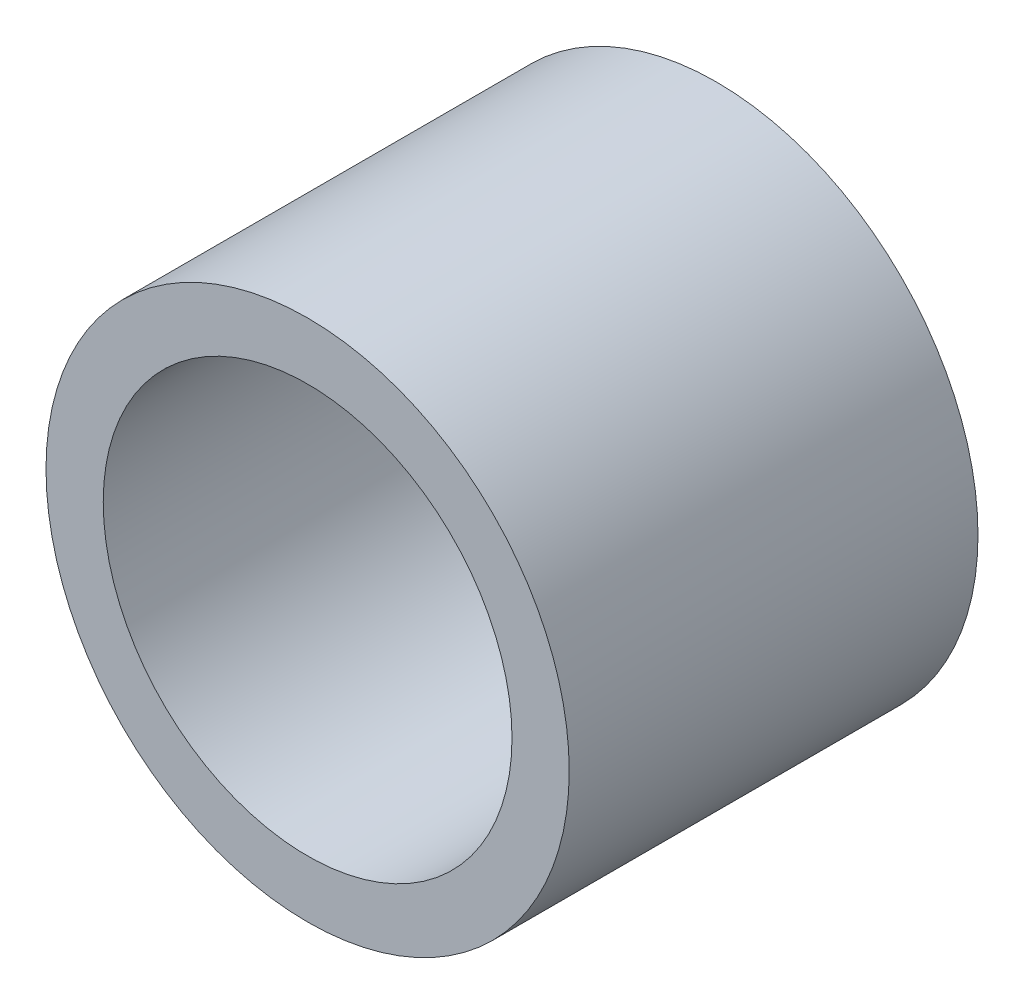
from build123d import *

# Parameters (mm, degrees)
SKETCH1_R      = 4.064
SKETCH1_R_2    = 3.175
EXTRUDE1_DEPTH = 6.35


with BuildPart() as part:
    # Sketch1 → Extrude1 (new body)
    with BuildSketch(Plane.XY):
        Circle(SKETCH1_R)
        Circle(SKETCH1_R_2, mode=Mode.SUBTRACT)
    extrude(amount=EXTRUDE1_DEPTH)


solid = part.part
